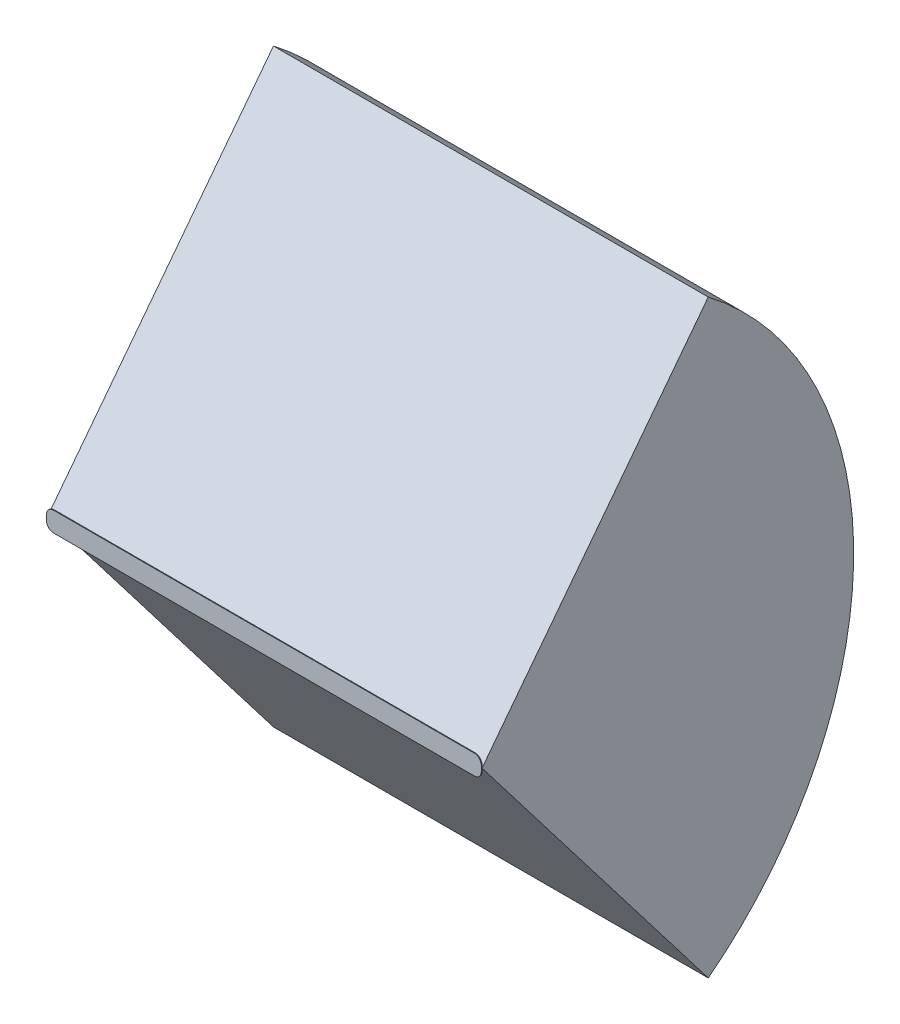
from build123d import *

# Parameters (mm, degrees)
BOSS_EXTRU_1_DEPTH = 1
BOSS_EXTRU_2_DEPTH = 616


with BuildPart() as part:
    # Esquisse1 → Boss.-Extru.1 (new body)
    with BuildSketch(Plane.XY):
        with BuildLine():
            Line((-298, -14), (298, -14))
            ThreePointArc((298, -14), (305.071067812, -11.071067812), (308, -4))
            Line((308, -4), (308, 4))
            ThreePointArc((308, 4), (305.071067812, 11.071067812), (298, 14))
            Line((298, 14), (-298, 14))
            ThreePointArc((-298, 14), (-305.071067812, 11.071067812), (-308, 4))
            Line((-308, 4), (-308, -4))
            ThreePointArc((-308, -4), (-305.071067812, -11.071067812), (-298, -14))
        make_face()
    extrude(amount=BOSS_EXTRU_1_DEPTH)


with BuildPart() as body_2:
    # Esquisse3 → Boss.-Extru.2 (new, through all)
    with BuildSketch(Plane(origin=(308, 0, 0), x_dir=(0, 0, -1), z_dir=(1, 0, 0))):
        with BuildLine():
            Line((0, 0), (320.54421388, 417.741352646))
            ThreePointArc((320.54421388, 417.741352646), (526.551451202, 0), (320.54421388, -417.741352646))
            Line((320.54421388, -417.741352646), (0, 0))
        make_face()
    extrude(amount=-BOSS_EXTRU_2_DEPTH)


solid = Compound([part.part, body_2.part])
